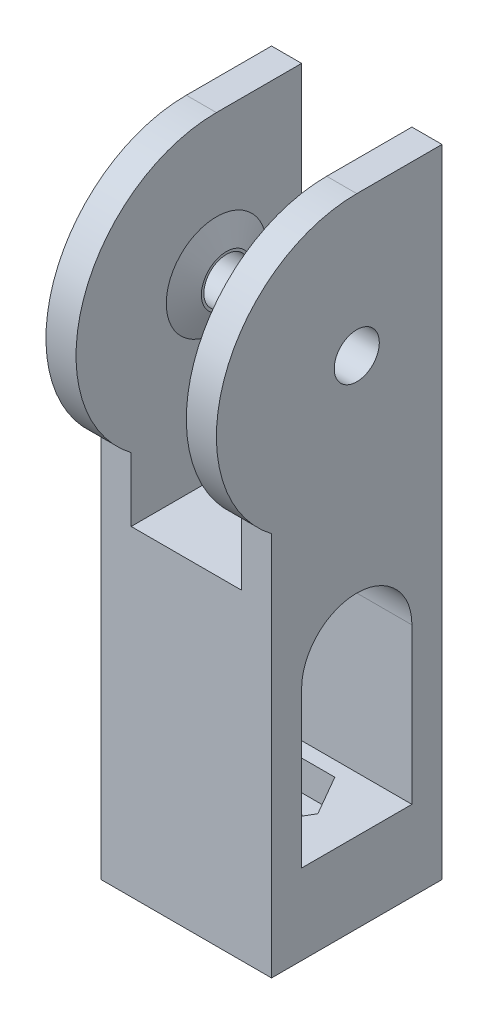
from build123d import *

# Parameters (mm, degrees)
BOSS_EXTRUDE1_DEPTH  = 22.5
CUT_EXTRUDE1_DEPTH   = 70.480213011
SKETCH3_R            = 2.3
CUT_EXTRUDE2_DEPTH   = 8
CUT_EXTRUDE3_DEPTH   = 3
SKETCH5_R            = 5
SKETCH6_R            = 2.5
M4_CLEARANCE_HOLE1_D = 4.5


with BuildPart() as part:
    # Sketch1 → Boss-Extrude1 (new body)
    with BuildSketch(Plane.XY):
        Polygon((0, 0), (17, 0), (17, 63.5), (14, 63.5), (14, 32), (3, 32), (3, 63.5), (0, 63.5), align=None)
    extrude(amount=BOSS_EXTRUDE1_DEPTH)

    # Sketch2 → Cut-Extrude1 (cut, through all)
    with BuildSketch(Plane(origin=(17, 0, 0), x_dir=(0, 0, -1), z_dir=(1, 0, 0))):
        with BuildLine():
            ThreePointArc((-3, 23.5), (-8.5, 29), (-14, 23.5))
            Line((-14, 23.5), (-14, 8))
            Line((-14, 8), (-3, 8))
            Line((-3, 8), (-3, 23.5))
        make_face()
        with BuildLine():
            ThreePointArc((-17, 38.375702269), (-21.049900398, 43.295163177), (-22.5, 49.5))
            Line((-22.5, 49.5), (-22.5, 0))
            Line((-22.5, 0), (-17, 0))
            Line((-17, 0), (-17, 38.375702269))
        make_face()
        with BuildLine():
            Line((-8.5, 63.5), (-22.5, 63.5))
            Line((-22.5, 63.5), (-22.5, 49.5))
            ThreePointArc((-22.5, 49.5), (-18.399494937, 59.399494937), (-8.5, 63.5))
        make_face()
    extrude(amount=-CUT_EXTRUDE1_DEPTH, mode=Mode.SUBTRACT)

    # Sketch3 → Cut-Extrude2 (cut)
    with BuildSketch(Plane.XZ):
        with Locations(Location((8.5, 8.5, 0), (0, 0, 270))):
            Circle(SKETCH3_R)
    extrude(amount=-CUT_EXTRUDE2_DEPTH, mode=Mode.SUBTRACT)

    # Sketch4 → Cut-Extrude3 (cut)
    with BuildSketch(Plane(origin=(0, 8, 0), x_dir=(1, 0, 0), z_dir=(0, 1, 0))):
        Polygon((3.881197846, -8.5), (6.190598923, -12.5), (10.809401077, -12.5), (13.118802154, -8.5), (10.809401077, -4.5), (6.190598923, -4.5), align=None)
    extrude(amount=-CUT_EXTRUDE3_DEPTH, mode=Mode.SUBTRACT)

    # Sketch5 → Loft1 section 0
    with BuildSketch(Plane.ZY.offset(-14)):
        with Locations((8.5, 49.5)):
            Circle(SKETCH5_R)
    # Sketch6 → Loft1 section 1
    with BuildSketch(Plane.ZY.offset(-13)):
        with Locations((8.5, 49.5)):
            Circle(SKETCH6_R)
    loft1 = loft()

    # Mirror1: Loft1 across plane
    add(loft1.mirror(Plane.ZY.offset(-8.5)))

    # M4 Clearance Hole1 (through all)
    with Locations(Plane(origin=(17, 49.5, 8.5), x_dir=(0, 0, 1), z_dir=(1, 0, 0))):
        with Locations((0, 0)):
            Hole(M4_CLEARANCE_HOLE1_D / 2)


solid = part.part
